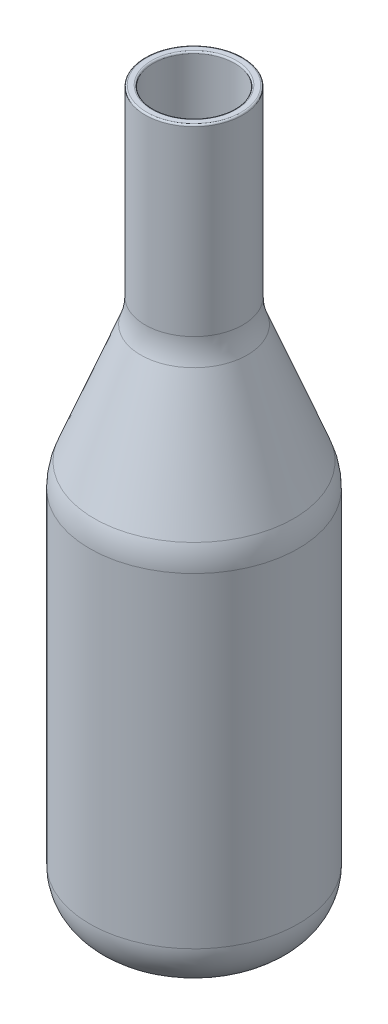
from build123d import *


with BuildPart() as part:
    # Sketch1 → Revolve1 (revolve)
    with BuildSketch(Plane(origin=(0, 0, 0), x_dir=(0, 0, -1), z_dir=(1, 0, 0))):
        with BuildLine():
            Line((0, 0), (17, 0))
            ThreePointArc((17, 0), (27.606601718, 4.393398282), (32, 15))
            Line((32, 15), (32, 114.751276219))
            ThreePointArc((32, 114.751276219), (31.652603278, 118.46276977), (30.622481562, 122.045327253))
            Line((30.622481562, 122.045327253), (16.377518438, 158.414220463))
            ThreePointArc((16.377518438, 158.414220463), (15.347396722, 161.996777946), (15, 165.708271497))
            Line((15, 165.708271497), (15, 221.5))
            ThreePointArc((15, 221.5), (14.853553391, 221.853553391), (14.5, 222))
            Line((14.5, 222), (13, 222))
            ThreePointArc((13, 222), (12.646446609, 221.853553391), (12.5, 221.5))
            Line((12.5, 221.5), (12.5, 211.633388036))
            Line((12.5, 211.633388036), (12.5, 165.23613385))
            ThreePointArc((12.5, 165.23613385), (12.847396722, 161.524640298), (13.877518438, 157.942082816))
            Line((13.877518438, 157.942082816), (28.122481562, 121.573189605))
            ThreePointArc((28.122481562, 121.573189605), (29.152603278, 117.990632123), (29.5, 114.279138571))
            Line((29.5, 114.279138571), (29.5, 17.5))
            ThreePointArc((29.5, 17.5), (25.106601718, 6.893398282), (14.5, 2.5))
            Line((14.5, 2.5), (0, 2.5))
            Line((0, 2.5), (0, 0))
        make_face()
    revolve(axis=Axis((0, 0, 0), (0, 1, 0)))


solid = part.part
